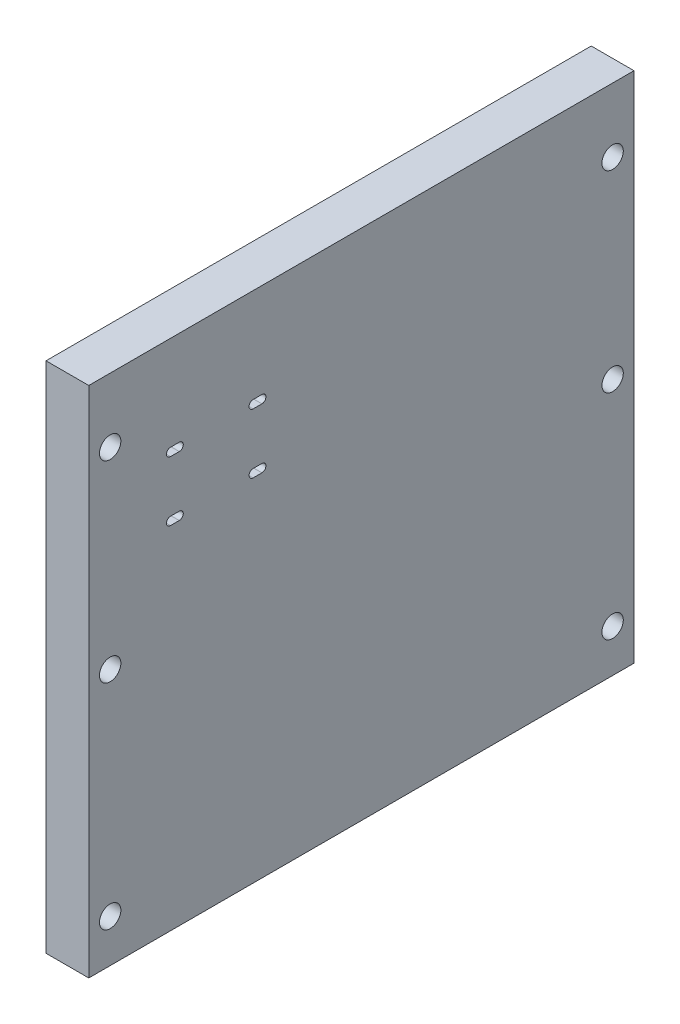
from build123d import *

# Parameters (mm, degrees)
SKETCH1_W           = 161.925
SKETCH1_H           = 152.4
SKETCH1_R           = 3.175
BOSS_EXTRUDE1_DEPTH = 12.7


with BuildPart() as part:
    # Sketch1 → Boss-Extrude1 (new body)
    with BuildSketch(Plane(origin=(0, 0, 0), x_dir=(0, 0, -1), z_dir=(1, 0, 0))):
        with Locations((20.6375, 0)):
            Rectangle(SKETCH1_W, SKETCH1_H)
        with Locations((-53.975, 57.15)):
            Circle(SKETCH1_R, mode=Mode.SUBTRACT)
        with Locations((-53.975, 0)):
            Circle(SKETCH1_R, mode=Mode.SUBTRACT)
        with Locations((-53.975, -63.5)):
            Circle(SKETCH1_R, mode=Mode.SUBTRACT)
        with Locations((95.25, 57.15)):
            Circle(SKETCH1_R, mode=Mode.SUBTRACT)
        with Locations((95.25, 0)):
            Circle(SKETCH1_R, mode=Mode.SUBTRACT)
        with Locations((95.25, -63.5)):
            Circle(SKETCH1_R, mode=Mode.SUBTRACT)
        with BuildLine():
            Line((-36.055, 30.43), (-33.455, 30.43))
            ThreePointArc((-33.455, 30.43), (-32.255, 29.23), (-33.455, 28.03))
            Line((-33.455, 28.03), (-36.055, 28.03))
            ThreePointArc((-36.055, 28.03), (-37.255, 29.23), (-36.055, 30.43))
        make_face(mode=Mode.SUBTRACT)
        with BuildLine():
            Line((-8.915, 28.03), (-11.515, 28.03))
            ThreePointArc((-11.515, 28.03), (-12.715, 29.23), (-11.515, 30.43))
            Line((-11.515, 30.43), (-8.915, 30.43))
            ThreePointArc((-8.915, 30.43), (-7.715, 29.23), (-8.915, 28.03))
        make_face(mode=Mode.SUBTRACT)
        with BuildLine():
            ThreePointArc((-11.515, 45.77), (-12.715, 46.97), (-11.515, 48.17))
            Line((-11.515, 48.17), (-8.915, 48.17))
            ThreePointArc((-8.915, 48.17), (-7.715, 46.97), (-8.915, 45.77))
            Line((-8.915, 45.77), (-11.515, 45.77))
        make_face(mode=Mode.SUBTRACT)
        with BuildLine():
            Line((-36.055, 48.17), (-33.455, 48.17))
            ThreePointArc((-33.455, 48.17), (-32.255, 46.97), (-33.455, 45.77))
            Line((-33.455, 45.77), (-36.055, 45.77))
            ThreePointArc((-36.055, 45.77), (-37.255, 46.97), (-36.055, 48.17))
        make_face(mode=Mode.SUBTRACT)
    extrude(amount=BOSS_EXTRUDE1_DEPTH)


solid = part.part
